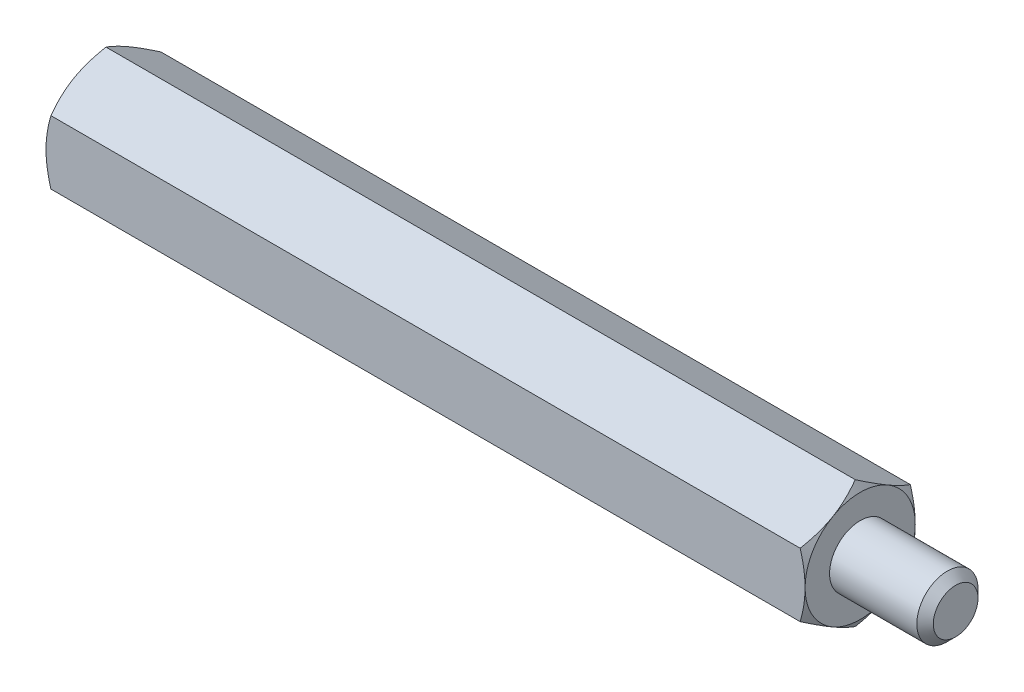
from build123d import *

# Parameters (mm, degrees)
SKETCH2_R         = 1.25
EXTRUDE1_DEPTH    = 3.9
CHAMFER1_SIZE     = 0.3375
EXTRUDE4_DEPTH    = 31
SKETCH8_OUTSIDE_W = 138.56
SKETCH8_OUTSIDE_H = 139.256
SKETCH8_OUTSIDE_R = 2.25
EXTRUDE5_DEPTH    = 36.068825187
EXTRUDE5_DRAFT    = -60
SKETCH9_OUTSIDE_W = 125.124
SKETCH9_OUTSIDE_H = 125.82
SKETCH9_OUTSIDE_R = 2.25
EXTRUDE6_DEPTH    = 32.189942289
EXTRUDE6_DRAFT    = -60
EXTRUDE7_START    = -4.8
SKETCH10_R        = 1.25
EXTRUDE7_DEPTH    = 4.8
SKETCH13_R        = 1.3008
EXTRUDE8_DEPTH    = 36.068825187


with BuildPart() as part:
    # Sketch2 → Extrude1 (new body)
    with BuildSketch(Plane(origin=(17.45, 0, 0), x_dir=(0, 0, -1), z_dir=(1, 0, 0))):
        Circle(SKETCH2_R)
    extrude(amount=-EXTRUDE1_DEPTH)

    # Chamfer1
    chamfer1_edges = [part.edges().sort_by_distance(p)[0] for p in [
        (17.45, 0, 1.25),
    ]]
    chamfer(chamfer1_edges, length=CHAMFER1_SIZE)

    # Sketch7 → Extrude4 (add)
    with BuildSketch(Plane(origin=(13.55, 0, 0), x_dir=(0, 0, -1), z_dir=(1, 0, 0))):
        Polygon((0, 2.598076211), (-2.25, 1.299038106), (-2.25, -1.299038106), (0, -2.598076211), (2.25, -1.299038106), (2.25, 1.299038106), align=None)
    extrude(amount=-EXTRUDE4_DEPTH)


with BuildPart() as extrude5_tool:
    # Sketch8 outside → Extrude5 (with draft: the straight prism first)
    with BuildSketch(Plane.ZY.offset(17.45)):
        Rectangle(SKETCH8_OUTSIDE_W, SKETCH8_OUTSIDE_H)
        Circle(SKETCH8_OUTSIDE_R, mode=Mode.SUBTRACT)
    extrude(amount=-EXTRUDE5_DEPTH)
    # Extrude5: the draft: its side faces are tilted about the plane it starts from
    extrude5_sides = [extrude5_tool.faces().sort_by_distance(p)[0] for p in [
        (0.584412594, -69.628, 0),
        (0.584412594, 0, 69.28),
        (0.584412594, 69.628, 0),
        (0.584412594, 0, -69.28),
        (0.584412594, 0, -2.25),
    ]]
    draft(extrude5_sides, Plane.ZY.offset(17.45), EXTRUDE5_DRAFT)


with BuildPart() as part_1:
    add(part.part)

    # Extrude5: cut by extrude5_tool
    add(extrude5_tool.part, mode=Mode.SUBTRACT)


with BuildPart() as extrude6_tool:
    # Sketch9 outside → Extrude6 (with draft: the straight prism first)
    with BuildSketch(Plane(origin=(13.55, 0, 0), x_dir=(0, 0, -1), z_dir=(1, 0, 0))):
        Rectangle(SKETCH9_OUTSIDE_W, SKETCH9_OUTSIDE_H)
        Circle(SKETCH9_OUTSIDE_R, mode=Mode.SUBTRACT)
    extrude(amount=-EXTRUDE6_DEPTH)
    # Extrude6: the draft: its side faces are tilted about the plane it starts from
    extrude6_sides = [extrude6_tool.faces().sort_by_distance(p)[0] for p in [
        (-2.544971145, -62.91, 0),
        (-2.544971145, 0, -62.562),
        (-2.544971145, 62.91, 0),
        (-2.544971145, 0, 62.562),
        (-2.544971145, 0, 2.25),
    ]]
    draft(extrude6_sides, Plane(origin=(13.55, 0, 0), x_dir=(0, 0, -1), z_dir=(1, 0, 0)), EXTRUDE6_DRAFT)


with BuildPart() as part_2:
    add(part_1.part)

    # Extrude6: cut by extrude6_tool
    add(extrude6_tool.part, mode=Mode.SUBTRACT)

    # Sketch10 → Extrude7 (cut)
    with BuildSketch(Plane.ZY.offset(17.45).offset(EXTRUDE7_START)):
        with Locations(Location((0, 0, 0), (0, 0, 180))):
            Circle(SKETCH10_R)
    extrude(amount=EXTRUDE7_DEPTH, mode=Mode.SUBTRACT)

    # Sketch13 → Extrude8 (cut)
    with BuildSketch(Plane.ZY.offset(17.45)):
        Circle(SKETCH13_R)
    extrude(amount=EXTRUDE8_DEPTH, mode=Mode.SUBTRACT)

    # Extrude8 cone 1 section (through the dimple's axis) → Extrude8 other way (revolve, cut)
    with BuildSketch(Plane(origin=(-17.45, 0, 0), x_dir=(0, 0, 1), z_dir=(0, 1, 0))):
        Polygon((0, 0), (1.3008, 0), (0, 1.3008), align=None)
    revolve(axis=Axis((-17.45, 0, 0), (1, 0, 0)), mode=Mode.SUBTRACT)


solid = part_2.part
